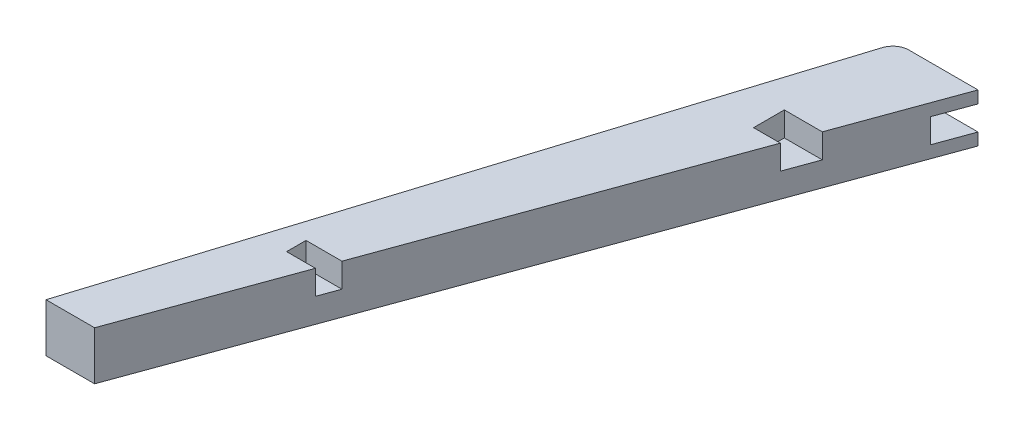
from build123d import *

# Parameters (mm, degrees)
SALIENTE_EXTRUIR1_DEPTH = 15
CROQUIS2_W              = 25
CROQUIS2_H              = 15
CORTAR_EXTRUIR1_DEPTH   = 21.55
REDONDEO2_R             = 10
CROQUIS3_W              = 40
CROQUIS3_H              = 19
CROQUIS3_H_2            = 12
CORTAR_EXTRUIR2_DEPTH   = 15


with BuildPart() as part:
    # Croquis1 → Saliente-Extruir1 (new, symmetric)
    with BuildSketch(Plane(origin=(0, 0, 0), x_dir=(1, 0, 0), z_dir=(0, 1, 0))):
        Polygon((15, 0), (160.588093706, 400), (110.588093706, 400), (-15, 0), align=None)
    extrude(amount=SALIENTE_EXTRUIR1_DEPTH, both=True)

    # Croquis2 → Cortar-Extruir1 (cut)
    with BuildSketch(Plane(origin=(0, 0, -400), x_dir=(-1, 0, 0), z_dir=(0, 0, -1))):
        with Locations((-148.088093706, 0)):
            Rectangle(CROQUIS2_W, CROQUIS2_H)
    extrude(amount=-CORTAR_EXTRUIR1_DEPTH, mode=Mode.SUBTRACT)

    # Redondeo2
    redondeo2_edges = [part.edges().sort_by_distance(p)[0] for p in [
        (110.588093706, 0, -400),
    ]]
    fillet(redondeo2_edges, radius=REDONDEO2_R)

    # Croquis3 → Cortar-Extruir2 (cut)
    with BuildSketch(Plane(origin=(0, 15, 0), x_dir=(1, 0, 0), z_dir=(0, 1, 0))):
        with Locations((131.470474965, 320)):
            Rectangle(CROQUIS3_W, CROQUIS3_H)
        with Locations((53.580844832, 106)):
            Rectangle(CROQUIS3_W, CROQUIS3_H_2)
    extrude(amount=-CORTAR_EXTRUIR2_DEPTH, mode=Mode.SUBTRACT)


solid = part.part
